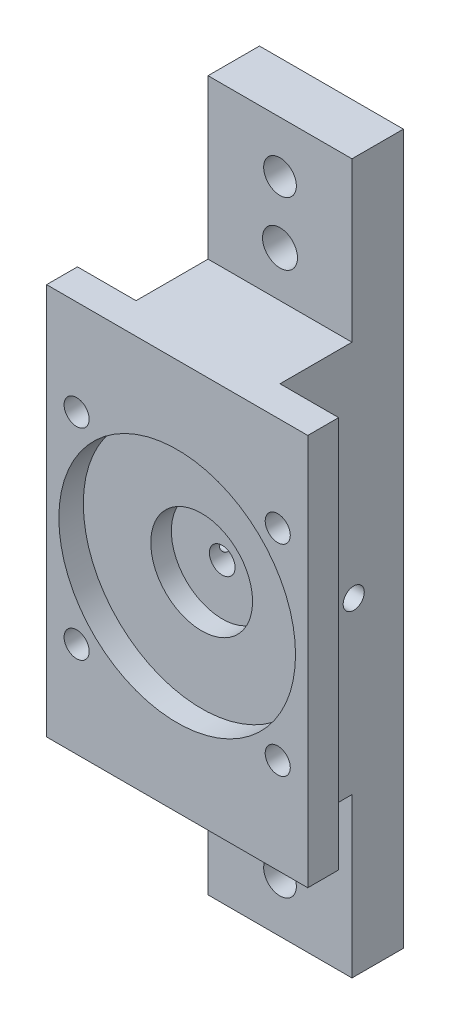
from build123d import *

# Parameters (mm, degrees)
SKETCH1_W                          = 25.4
SKETCH1_H                          = 38.1
BOSS_EXTRUDE1_DEPTH                = 15
SKETCH2_R                          = 11.51
CUT_EXTRUDE1_DEPTH                 = 2.38
SKETCH3_R                          = 4.95
CUT_EXTRUDE2_DEPTH                 = 2
SKETCH4_R                          = 0.625
CUT_EXTRUDE3_DEPTH                 = 48.005897502
SKETCH5_R                          = 1.22
CUT_EXTRUDE4_DEPTH                 = 49.184748624
SKETCH7_W                          = 5.7
SKETCH7_H                          = 12
CUT_EXTRUDE5_DEPTH                 = 49.184748624
SKETCH12_W                         = 5
SKETCH12_H                         = 15.45
BOSS_EXTRUDE2_DEPTH                = 14
SKETCH13_R                         = 1.59
SKETCH13_R_2                       = 1.7
CUT_EXTRUDE8_DEPTH                 = 7.5
TAP_DRILL_FOR_M2_5X0_45_TAP1_D     = 2.05
TAP_DRILL_FOR_M2_5X0_45_TAP1_DEPTH = 2.15
TAP_DRILL_FOR_M2_5X0_45_TAP1_TIP   = 0.615882135
SKETCH21_W                         = 5
SKETCH21_H                         = 13
CUT_EXTRUDE10_DEPTH                = 0.8
FILLET1_R                          = 0.79
SKETCH22_W                         = 8
SKETCH22_H                         = 10
BOSS_EXTRUDE3_DEPTH                = 5.7
SKETCH23_R                         = 2.02
CUT_EXTRUDE11_DEPTH                = 5.5
TAP_DRILL_FOR_10_32_TAP1_D         = 4.0386
TAP_DRILL_FOR_10_32_TAP1_DEPTH     = 5.5
TAP_DRILL_FOR_10_32_TAP1_TIP       = 1.213317848
SKETCH26_R                         = 0.625
CUT_EXTRUDE12_DEPTH                = 12.7
SKETCH27_R                         = 1.25
CUT_EXTRUDE13_DEPTH                = 8.22


with BuildPart() as part:
    # Sketch1 → Boss-Extrude1 (new body)
    with BuildSketch(Plane.XY):
        with Locations((12.7, 19.05)):
            Rectangle(SKETCH1_W, SKETCH1_H)
    extrude(amount=BOSS_EXTRUDE1_DEPTH)

    # Sketch2 → Cut-Extrude1 (cut)
    with BuildSketch(Plane.XY.offset(15)):
        with Locations((12.7, 19.05)):
            Circle(SKETCH2_R)
    extrude(amount=-CUT_EXTRUDE1_DEPTH, mode=Mode.SUBTRACT)

    # Sketch3 → Cut-Extrude2 (cut)
    with BuildSketch(Plane.XY.offset(12.62)):
        with Locations((12.7, 19.05)):
            Circle(SKETCH3_R)
    extrude(amount=-CUT_EXTRUDE2_DEPTH, mode=Mode.SUBTRACT)

    # Sketch4 → Cut-Extrude3 (cut, through all)
    with BuildSketch(Plane.XY.offset(10.62)):
        with Locations((12.7, 19.05)):
            Circle(SKETCH4_R)
    extrude(amount=-CUT_EXTRUDE3_DEPTH, mode=Mode.SUBTRACT)

    # Sketch5 → Cut-Extrude4 (cut, through all)
    with BuildSketch(Plane.XY.offset(15)):
        with Locations((2.92, 28.83)):
            Circle(SKETCH5_R)
        with Locations((22.48, 28.83)):
            Circle(SKETCH5_R)
        with Locations((22.48, 9.27)):
            Circle(SKETCH5_R)
        with Locations((2.92, 9.27)):
            Circle(SKETCH5_R)
    extrude(amount=-CUT_EXTRUDE4_DEPTH, mode=Mode.SUBTRACT)

    # Sketch7 → Cut-Extrude5 (cut, through all)
    with BuildSketch(Plane(origin=(0, 38.1, 0), x_dir=(1, 0, 0), z_dir=(0, 1, 0))):
        with Locations((2.85, -6)):
            Rectangle(SKETCH7_W, SKETCH7_H)
        with Locations((22.55, -6)):
            Rectangle(SKETCH7_W, SKETCH7_H)
    extrude(amount=-CUT_EXTRUDE5_DEPTH, mode=Mode.SUBTRACT)

    # Sketch12 → Boss-Extrude2 (add)
    with BuildSketch(Plane(origin=(19.7, 0, 0), x_dir=(0, 0, -1), z_dir=(1, 0, 0))):
        with Locations((-2.5, 45.825)):
            Rectangle(SKETCH12_W, SKETCH12_H)
        with Locations((-2.5, -7.725)):
            Rectangle(SKETCH12_W, SKETCH12_H)
    extrude(amount=-BOSS_EXTRUDE2_DEPTH)

    # Sketch13 → Cut-Extrude8 (cut)
    with BuildSketch(Plane.XY.offset(5)):
        with Locations((12.7, 48.55)):
            Circle(SKETCH13_R)
        with Locations((12.7, 42.55)):
            Circle(SKETCH13_R_2)
        with Locations((12.7, -4.45)):
            Circle(SKETCH13_R_2)
        with Locations((12.7, -10.45)):
            Circle(SKETCH13_R)
    extrude(amount=-CUT_EXTRUDE8_DEPTH, mode=Mode.SUBTRACT)

    # Tap Drill for M2.5x0.45 Tap1
    with Locations(Plane(origin=(19.7, 0, 0), x_dir=(0, 0, -1), z_dir=(1, 0, 0))):
        with Locations((-4.83, 16.46)):
            Hole(TAP_DRILL_FOR_M2_5X0_45_TAP1_D / 2, depth=TAP_DRILL_FOR_M2_5X0_45_TAP1_DEPTH)
            with Locations((0, 0, -(TAP_DRILL_FOR_M2_5X0_45_TAP1_DEPTH + TAP_DRILL_FOR_M2_5X0_45_TAP1_TIP / 2))):  # 118° drill point
                Cone(0, TAP_DRILL_FOR_M2_5X0_45_TAP1_D / 2, TAP_DRILL_FOR_M2_5X0_45_TAP1_TIP, mode=Mode.SUBTRACT)

    # Sketch21 → Cut-Extrude10 (cut)
    with BuildSketch(Plane(origin=(0, 0, 0), x_dir=(-1, 0, 0), z_dir=(0, 0, -1))):
        with Locations((-12.7, 19.05)):
            Rectangle(SKETCH21_W, SKETCH21_H)
    extrude(amount=-CUT_EXTRUDE10_DEPTH, mode=Mode.SUBTRACT)

    # Fillet1
    fillet1_edges = [part.edges().sort_by_distance(p)[0] for p in [
        (10.2, 25.55, 0.4),
        (10.2, 12.55, 0.4),
        (15.2, 12.55, 0.4),
        (15.2, 25.55, 0.4),
    ]]
    fillet(fillet1_edges, radius=FILLET1_R)

    # Sketch22 → Boss-Extrude3 (add)
    with BuildSketch(Plane.ZY.offset(-5.7)):
        with Locations((8, 19.05)):
            Rectangle(SKETCH22_W, SKETCH22_H)
    extrude(amount=BOSS_EXTRUDE3_DEPTH)

    # Sketch23 → Cut-Extrude11 (cut)
    with BuildSketch(Plane.ZY):
        with Locations((9, 19.05)):
            Circle(SKETCH23_R)
    extrude(amount=-CUT_EXTRUDE11_DEPTH, mode=Mode.SUBTRACT)

    # Tap Drill for #10-32 Tap1
    with Locations(Plane.ZY):
        with Locations((9, 19.05)):
            Hole(TAP_DRILL_FOR_10_32_TAP1_D / 2, depth=TAP_DRILL_FOR_10_32_TAP1_DEPTH)
            with Locations((0, 0, -(TAP_DRILL_FOR_10_32_TAP1_DEPTH + TAP_DRILL_FOR_10_32_TAP1_TIP / 2))):  # 118° drill point
                Cone(0, TAP_DRILL_FOR_10_32_TAP1_D / 2, TAP_DRILL_FOR_10_32_TAP1_TIP, mode=Mode.SUBTRACT)

    # Sketch26 → Cut-Extrude12 (cut)
    with BuildSketch(Plane.ZY):
        with Locations((9, 19.05)):
            Circle(SKETCH26_R)
    extrude(amount=-CUT_EXTRUDE12_DEPTH, mode=Mode.SUBTRACT)

    # Sketch27 → Cut-Extrude13 (cut)
    with BuildSketch(Plane.XY.offset(10.62)):
        with Locations((12.7, 19.05)):
            Circle(SKETCH27_R)
    extrude(amount=-CUT_EXTRUDE13_DEPTH, mode=Mode.SUBTRACT)


solid = part.part
